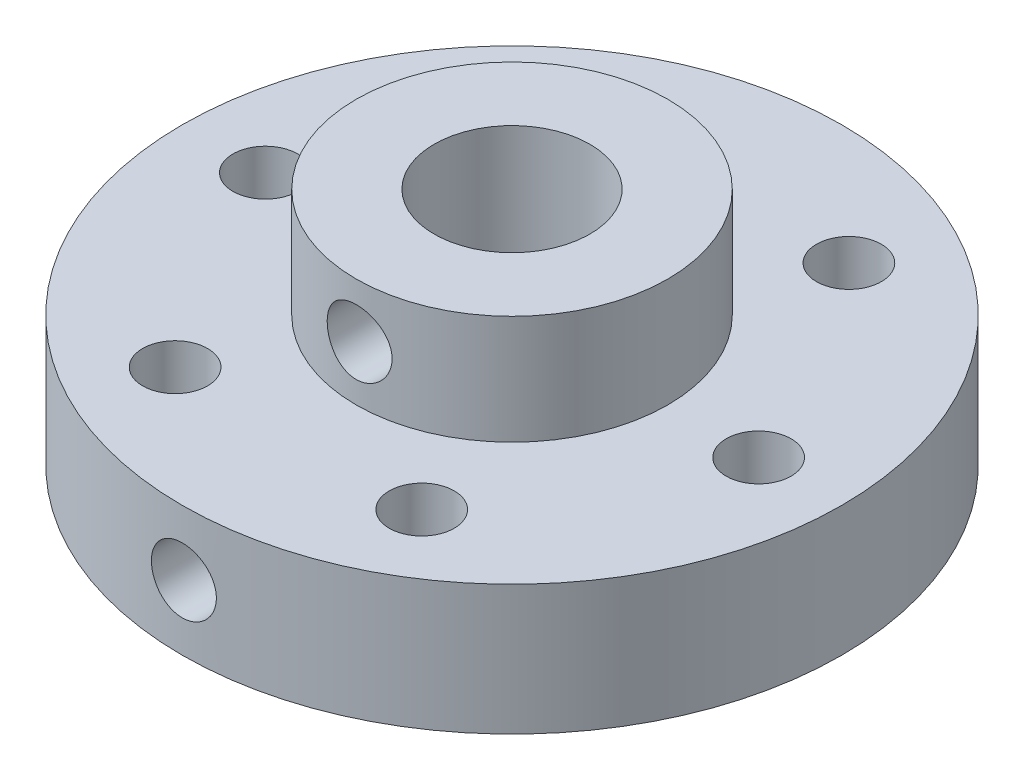
from build123d import *

# Parameters (mm, degrees)
TAP_DRILL_FOR_M3_TAP1_D          = 2.5
SKETCH6_W                        = 1.25
SKETCH6_H                        = 12.7
TAP_DRILL_FOR_M3_TAP2_AT_2_COUNT = 2
TAP_DRILL_FOR_M3_TAP2_AT_2_PITCH = 4.6


with BuildPart() as part:
    # Sketch1 → Revolve1 (revolve)
    with BuildSketch(Plane.XY, mode=Mode.PRIVATE) as revolve1_sk:
        Polygon((3, 0), (3, 9.2), (6, 9.2), (6, 5), (12.7, 5), (12.7, 0), align=None)
    revolve(revolve1_sk.sketch.rotate(Axis((0, 0, 0), (0, 1, 0)), 90), axis=Axis((0, 0, 0), (0, 1, 0)))

    # Tap Drill for M3 Tap1 (through all)
    with Locations(Plane(origin=(0, 5, 0), x_dir=(1, 0, 0), z_dir=(0, 1, 0))):
        with Locations((-9.5, 0), (-4.75, 8.227241336), (4.75, 8.227241336), (9.5, 0), (4.75, -8.227241336), (-4.75, -8.227241336)):
            Hole(TAP_DRILL_FOR_M3_TAP1_D / 2)

    # Sketch6 → Tap Drill for M3 Tap2 (revolve, cut)
    with BuildSketch(Plane(origin=(0, 2.5, 0), x_dir=(0, 1, 0), z_dir=(1, 0, 0))):
        with Locations((0.625, 6.35)):
            Rectangle(SKETCH6_W, SKETCH6_H)
    tap_drill_for_m3_tap2 = revolve(axis=Axis((0, 2.5, -6.35), (0, 0, 1)), mode=Mode.SUBTRACT)

    # Tap Drill for M3 Tap2 at 2: Tap Drill for M3 Tap2 ×2
    with Locations(*[(0, i * TAP_DRILL_FOR_M3_TAP2_AT_2_PITCH, 0) for i in range(1, TAP_DRILL_FOR_M3_TAP2_AT_2_COUNT)]):
        add(tap_drill_for_m3_tap2, mode=Mode.SUBTRACT)


solid = part.part
